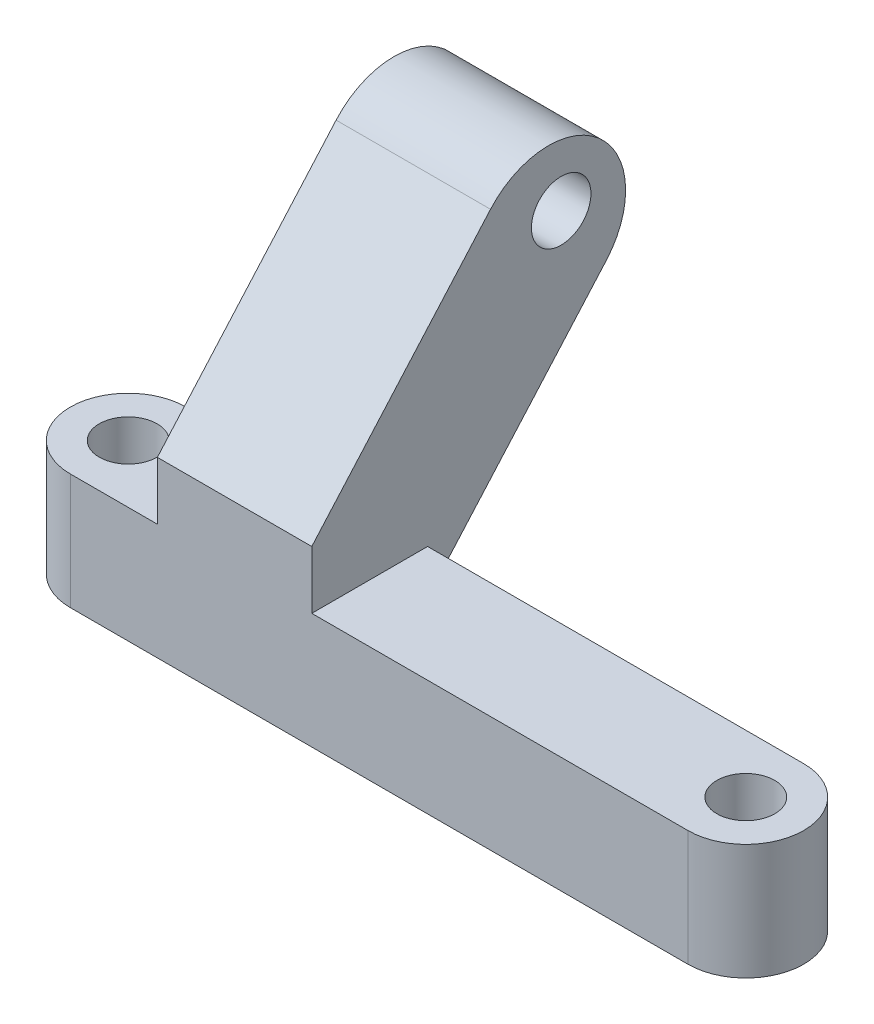
from build123d import *

# Parameters (mm, degrees)
SKETCH_1_R          = 1.5
EXTRUDE_2_DEPTH     = 6
SKETCH_1_4_W        = 8
SKETCH_1_4_H        = 6
EXTRUDE_3_DEPTH     = 3
EXTRUDE_28_DEPTH    = 8
SKETCH_8_R          = 1.542364341
CUT_EXTRUDE_2_DEPTH = 12


with BuildPart() as part:
    # 草圖1 → 填料-伸長2 (new body)
    with BuildSketch(Plane(origin=(0, 0, 0), x_dir=(1, 0, 0), z_dir=(0, 1, 0))):
        with BuildLine():
            Line((-38.676968887, -3), (-6.676968887, -3))
            ThreePointArc((-6.676968887, -3), (-3.676968887, 0), (-6.676968887, 3))
            Line((-6.676968887, 3), (-38.676968887, 3))
            ThreePointArc((-38.676968887, 3), (-41.676968887, 0), (-38.676968887, -3))
        make_face()
        with Locations((-38.676968887, 0)):
            Circle(SKETCH_1_R, mode=Mode.SUBTRACT)
        with Locations((-6.676968887, 0)):
            Circle(SKETCH_1_R, mode=Mode.SUBTRACT)
    extrude(amount=-EXTRUDE_2_DEPTH)

    # 草圖1<4> → 填料-伸長3 (add)
    with BuildSketch(Plane(origin=(0, 0, 0), x_dir=(1, 0, 0), z_dir=(0, 1, 0))):
        with Locations((-30.164668836, 0)):
            Rectangle(SKETCH_1_4_W, SKETCH_1_4_H)
    extrude(amount=EXTRUDE_3_DEPTH)

    # 草圖3 → 填料-伸長28 (add)
    with BuildSketch(Plane(origin=(-26.164668836, 0, 0), x_dir=(0, 0, -1), z_dir=(1, 0, 0))):
        with BuildLine():
            Line((3, -2.291502622), (12.260129589, 8.208497378))
            ThreePointArc((12.260129589, 8.208497378), (11.9058809, 13.854248689), (6.260129589, 13.5))
            Line((6.260129589, 13.5), (-3, 3))
            Line((-3, 3), (3, -2.291502622))
        make_face()
    extrude(amount=-EXTRUDE_28_DEPTH)

    # 草圖8 → 除料-伸長2 (cut)
    with BuildSketch(Plane(origin=(-26.164668836, 0, 0), x_dir=(0, 0, -1), z_dir=(1, 0, 0))):
        with Locations((9.921567416, 11.604248689)):
            Circle(SKETCH_8_R)
    extrude(amount=-CUT_EXTRUDE_2_DEPTH, mode=Mode.SUBTRACT)


solid = part.part
